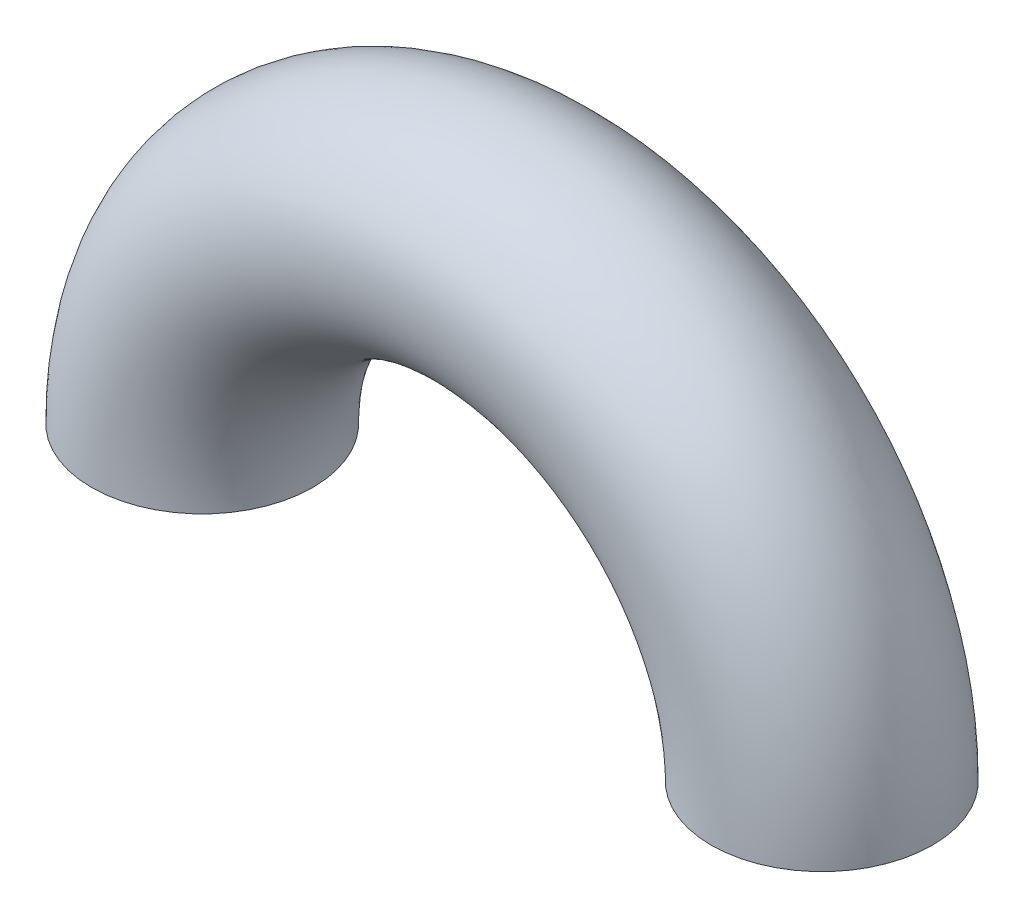
from build123d import *

# Parameters (mm, degrees)
SKETCH1_R           = 25
SKETCH1_R_2         = 20
REVOLVE_THIN1_ANGLE = 180


with BuildPart() as part:
    # Sketch1 → Revolve-Thin1 (revolve)
    with BuildSketch(Plane(origin=(0, 0, 0), x_dir=(1, 0, 0), z_dir=(0, 1, 0))):
        Circle(SKETCH1_R)
        Circle(SKETCH1_R_2, mode=Mode.SUBTRACT)
    revolve(axis=Axis((-70, 0, -98), (0, 0, 1)), revolution_arc=REVOLVE_THIN1_ANGLE)


solid = part.part
